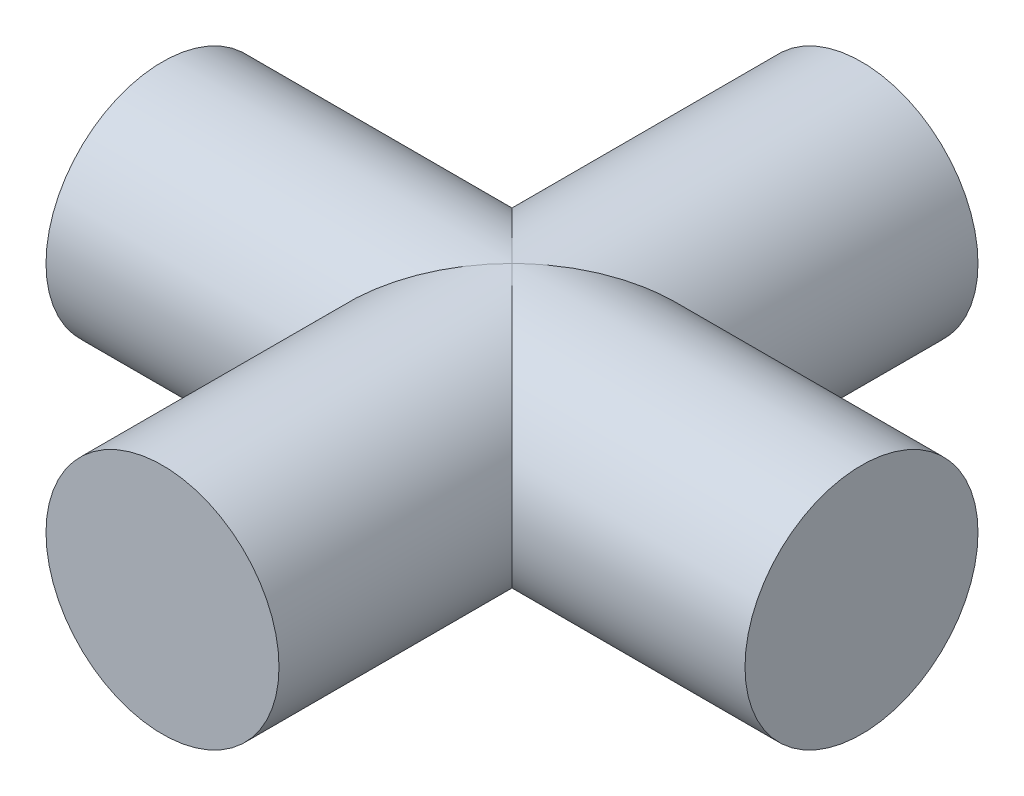
from build123d import *

# Parameters (mm, degrees)
BOSS_EXTRUDE1_DEPTH      = 30
BOSS_EXTRUDE1_DEPTH_BACK = 30
SKETCH1_R                = 10
BOSS_EXTRUDE2_DEPTH      = 30
BOSS_EXTRUDE2_DEPTH_BACK = 30
SKETCH2_R                = 10


with BuildPart() as part:
    # Sketch1 → Boss-Extrude1 (new, two sides: drawn at the far end of the back side and taken through both)
    with BuildSketch(Plane.XY.offset(-BOSS_EXTRUDE1_DEPTH_BACK)):
        Circle(SKETCH1_R)
    extrude(amount=BOSS_EXTRUDE1_DEPTH + BOSS_EXTRUDE1_DEPTH_BACK)

    # Sketch2 → Boss-Extrude2 (add, two sides: drawn at the far end of the back side and taken through both)
    with BuildSketch(Plane(origin=(0, 0, 0), x_dir=(0, 0, -1), z_dir=(1, 0, 0)).offset(-BOSS_EXTRUDE2_DEPTH_BACK)):
        Circle(SKETCH2_R)
    extrude(amount=BOSS_EXTRUDE2_DEPTH + BOSS_EXTRUDE2_DEPTH_BACK)


solid = part.part
